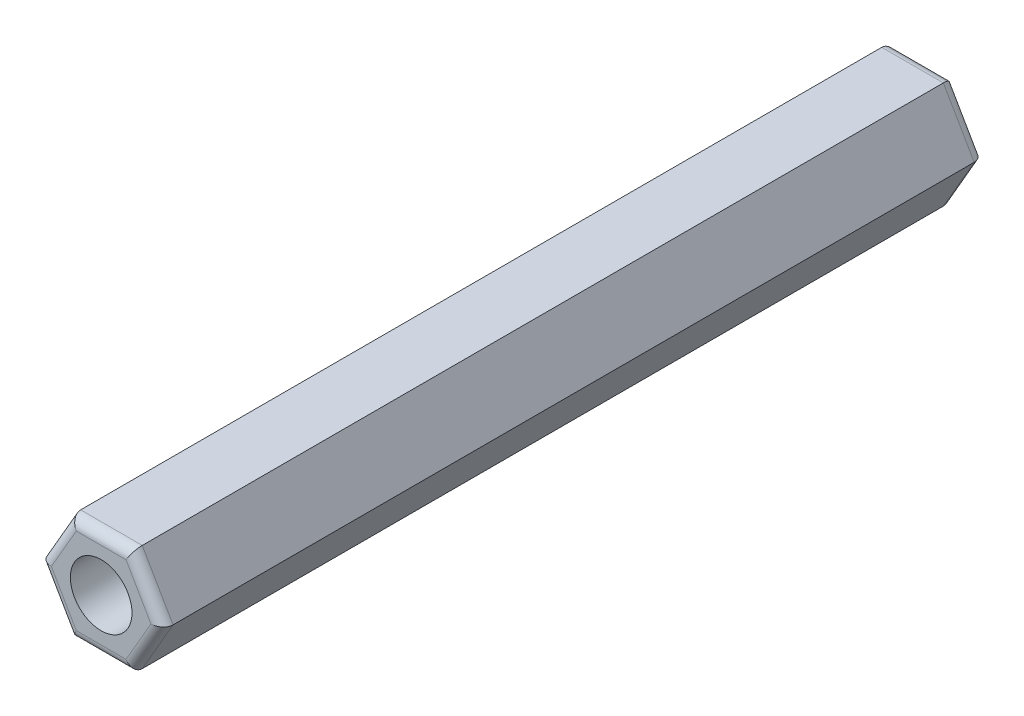
from build123d import *

# Parameters (mm, degrees)
EXTRUDE_2_DEPTH     = 40
SKETCH_3_R          = 1.75
CUT_EXTRUDE_1_DEPTH = 5
FILLET_1_R          = 0.5
SKETCH_2_R          = 1.5
CUT_EXTRUDE_2_DEPTH = 5


with BuildPart() as part:
    # ｽｹｯﾁ1 → ﾎﾞｽ - 押し出し2 (new body)
    with BuildSketch(Plane.XY):
        Polygon((3, 0), (1.5, 2.598076211), (-1.5, 2.598076211), (-3, 0), (-1.5, -2.598076211), (1.5, -2.598076211), align=None)
    extrude(amount=EXTRUDE_2_DEPTH)

    # ｽｹｯﾁ3 → ｶｯﾄ - 押し出し1 (cut)
    with BuildSketch(Plane(origin=(0, 0, 0), x_dir=(-1, 0, 0), z_dir=(0, 0, -1))):
        Circle(SKETCH_3_R)
    extrude(amount=-CUT_EXTRUDE_1_DEPTH, mode=Mode.SUBTRACT)

    # ﾌｨﾚｯﾄ1
    fillet_1_edges = [part.edges().sort_by_distance(p)[0] for p in [
        (0, 2.598076211, 40),
        (-2.25, 1.299038106, 40),
        (-2.25, -1.299038106, 40),
        (0, -2.598076211, 40),
        (2.25, -1.299038106, 40),
        (0, -2.598076211, 0),
        (-2.25, -1.299038106, 0),
        (-2.25, 1.299038106, 0),
        (2.25, 1.299038106, 40),
        (0, 2.598076211, 0),
        (2.25, 1.299038106, 0),
        (2.25, -1.299038106, 0),
    ]]
    fillet(fillet_1_edges, radius=FILLET_1_R)

    # ｽｹｯﾁ2 → ｶｯﾄ - 押し出し2 (cut)
    with BuildSketch(Plane.XY.offset(40)):
        Circle(SKETCH_2_R)
    extrude(amount=-CUT_EXTRUDE_2_DEPTH, mode=Mode.SUBTRACT)


solid = part.part
